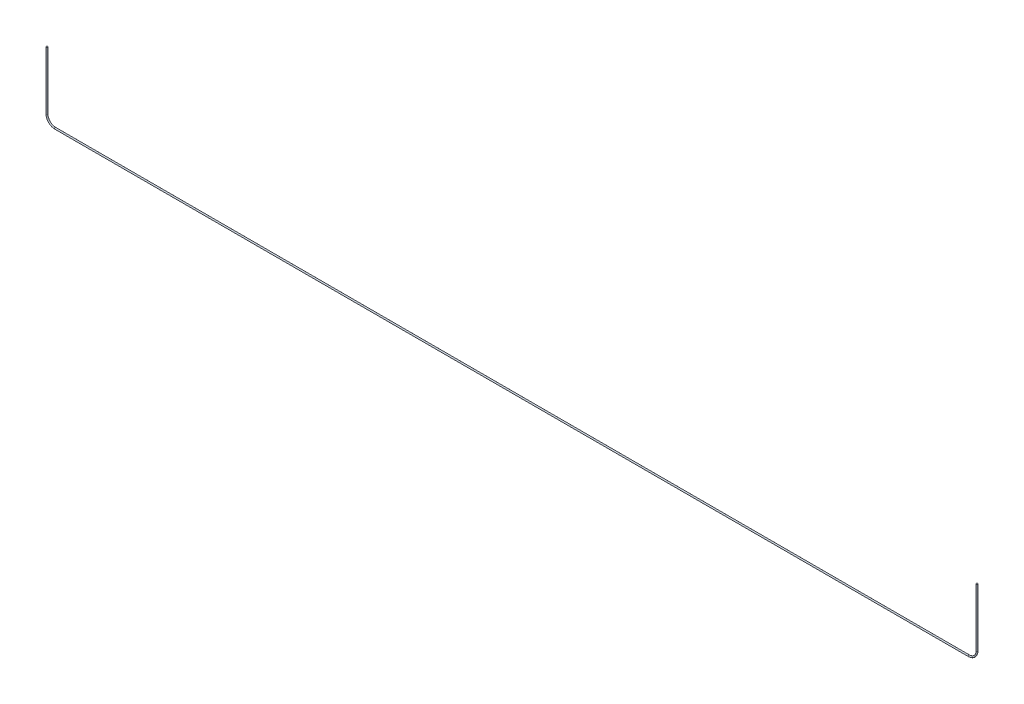
from build123d import *

# Parameters (mm, degrees)
SWEEP1_PROFILE_R = 6.35


with BuildPart() as part:
    # Sweep1: sweep along a path in Sketch1
    with BuildLine(Plane.XY) as sweep1_path:
        Line((-4200, 600), (-4200, 75))
        ThreePointArc((-4200, 75), (-4178.033008589, 21.966991411), (-4125, 0))
        Line((-4125, 0), (4125, 0))
        ThreePointArc((4125, 0), (4178.033008589, 21.966991411), (4200, 75))
        Line((4200, 75), (4200, 600))
    # Sweep1 profile (on start of the path) → Sweep1 (sweep)
    with BuildSketch(Plane(origin=(-4200, 600, 0), x_dir=(0, 0, -1), z_dir=(0, -1, 0))):
        Circle(SWEEP1_PROFILE_R)
    sweep(path=sweep1_path.line)


solid = part.part
